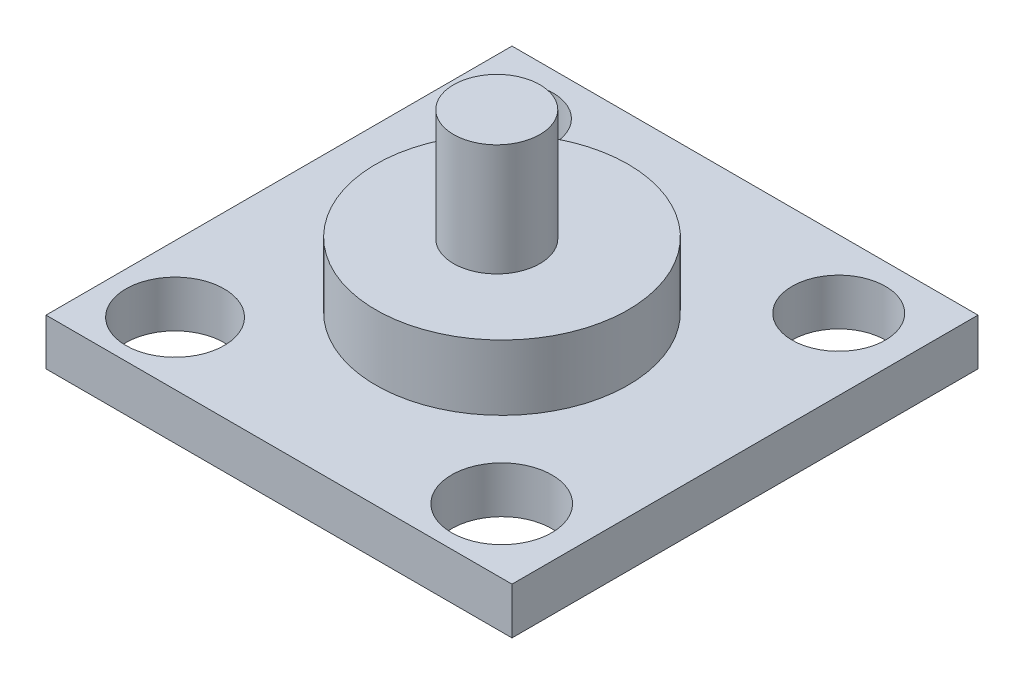
from build123d import *

# Parameters (mm, degrees)
SKETCH1_W                = 12.7
SKETCH1_H                = 12.7
BOSS_EXTRUDE1_DEPTH      = 1.27
SKETCH2_R                = 1.211003997
SKETCH2_R_2              = 1.271770102
SKETCH2_R_3              = 1.338907355
SKETCH2_R_4              = 1.365975295
CUT_EXTRUDE1_DEPTH       = 1.27
SKETCH3_R                = 3.438076728
BOSS_EXTRUDE2_DEPTH      = 1.778
BOSS_EXTRUDE3_DEPTH      = 3.048
BOSS_EXTRUDE3_DEPTH_BACK = 2.54
SKETCH4_R                = 1.176424435


with BuildPart() as part:
    # Sketch1 → Boss-Extrude1 (new body)
    with BuildSketch(Plane(origin=(0, 0, 0), x_dir=(1, 0, 0), z_dir=(0, 1, 0))):
        with Locations((61.354700157, 8.680443435)):
            Rectangle(SKETCH1_W, SKETCH1_H)
    extrude(amount=BOSS_EXTRUDE1_DEPTH)

    # Sketch2 → Cut-Extrude1 (cut)
    with BuildSketch(Plane(origin=(0, 1.27, 0), x_dir=(1, 0, 0), z_dir=(0, 1, 0))):
        with Locations(Location((56.671293602, 13.271817518, 0), (0, 0, 270))):
            Circle(SKETCH2_R)
        with Locations(Location((65.762094704, 13.177612325, 0), (0, 0, 270))):
            Circle(SKETCH2_R_2)
        with Locations(Location((56.812601392, 4.039708628, 0), (0, 0, 270))):
            Circle(SKETCH2_R_3)
        with Locations(Location((65.667889511, 4.086811224, 0), (0, 0, 270))):
            Circle(SKETCH2_R_4)
    extrude(amount=-CUT_EXTRUDE1_DEPTH, mode=Mode.SUBTRACT)

    # Sketch3 → Boss-Extrude2 (add)
    with BuildSketch(Plane(origin=(0, 1.27, 0), x_dir=(1, 0, 0), z_dir=(0, 1, 0))):
        with Locations(Location((61.153985379, 8.608321241, 0), (0, 0, 90))):
            Circle(SKETCH3_R)
    extrude(amount=BOSS_EXTRUDE2_DEPTH)

    # Sketch4 → Boss-Extrude3 (add, two sides: drawn at the far end of the back side and taken through both)
    with BuildSketch(Plane(origin=(0, 3.048, 0), x_dir=(1, 0, 0), z_dir=(0, 1, 0)).offset(-BOSS_EXTRUDE3_DEPTH_BACK)):
        with Locations(Location((61.122804521, 8.49685939, 0), (0, 0, 270))):
            Circle(SKETCH4_R)
    extrude(amount=BOSS_EXTRUDE3_DEPTH + BOSS_EXTRUDE3_DEPTH_BACK)


solid = part.part
